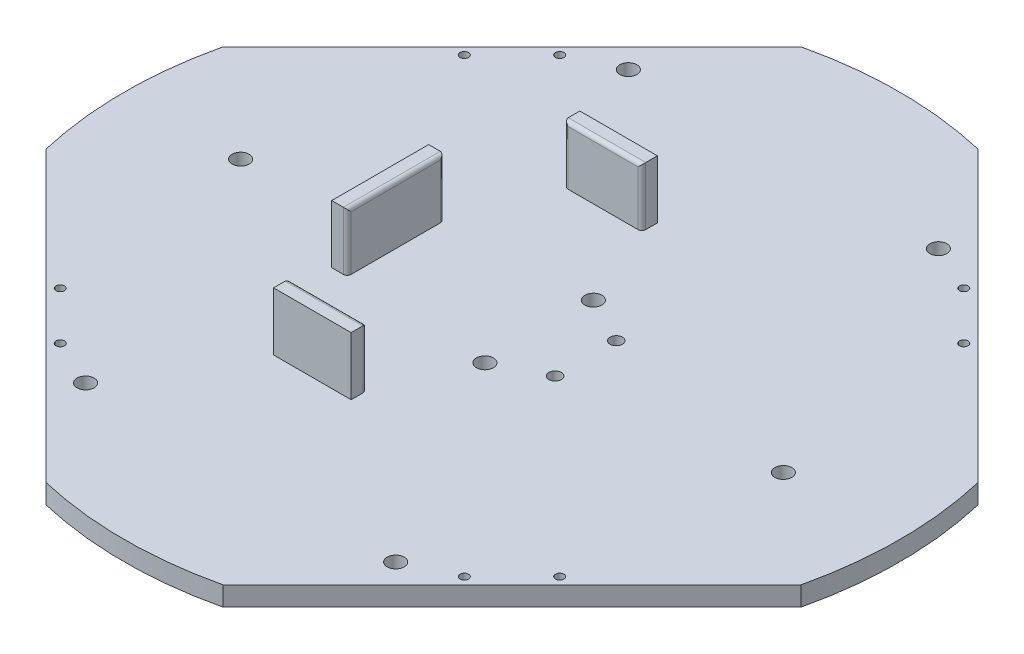
from build123d import *

# Parameters (mm, degrees)
BOSS_EXTRUDE1_DEPTH = 5
SKETCH2_R           = 2.2
CUT_EXTRUDE1_DEPTH  = 142.509716981
SKETCH3_R           = 1.1
SKETCH3_R_2         = 1.6
CUT_EXTRUDE3_DEPTH  = 142.509716981
SKETCH3_3_W         = 20
SKETCH3_3_H         = 4
SKETCH3_3_W_2       = 4
SKETCH3_3_H_2       = 25
BOSS_EXTRUDE2_DEPTH = 15
FILLET1_R           = 1


with BuildPart() as part:
    # Sketch1 → Boss-Extrude1 (new body)
    with BuildSketch(Plane(origin=(0, 0, 0), x_dir=(1, 0, 0), z_dir=(0, 1, 0))):
        with BuildLine():
            Line((97.353237465, -22.854915336), (22.854915336, -97.353237465))
            ThreePointArc((22.854915336, -97.353237465), (0, -100), (-22.854915336, -97.353237465))
            Line((-22.854915336, -97.353237465), (-97.353237465, -22.854915336))
            ThreePointArc((-97.353237465, -22.854915336), (-100, 0), (-97.353237465, 22.854915336))
            Line((-97.353237465, 22.854915336), (-22.854915336, 97.353237465))
            ThreePointArc((-22.854915336, 97.353237465), (0, 100), (22.854915336, 97.353237465))
            Line((22.854915336, 97.353237465), (97.353237465, 22.854915336))
            ThreePointArc((97.353237465, 22.854915336), (100, 0), (97.353237465, -22.854915336))
        make_face()
    extrude(amount=BOSS_EXTRUDE1_DEPTH)

    # Sketch2 → Cut-Extrude1 (cut, through all)
    with BuildSketch(Plane(origin=(0, 5, 0), x_dir=(1, 0, 0), z_dir=(0, 1, 0))):
        with Locations((-40, -70)):
            Circle(SKETCH2_R)
        with Locations((40, -70)):
            Circle(SKETCH2_R)
        with Locations((40, 70)):
            Circle(SKETCH2_R)
        with Locations((-40, 70)):
            Circle(SKETCH2_R)
        with Locations((-70, 0)):
            Circle(SKETCH2_R)
        with Locations((70, 0)):
            Circle(SKETCH2_R)
        with Locations((7, -14)):
            Circle(SKETCH2_R)
        with Locations((7, 14)):
            Circle(SKETCH2_R)
    extrude(amount=-CUT_EXTRUDE1_DEPTH, mode=Mode.SUBTRACT)

    # Sketch3 → Cut-Extrude3 (cut, through all)
    with BuildSketch(Plane(origin=(0, 5, 0), x_dir=(1, 0, 0), z_dir=(0, 1, 0))):
        with Locations((-52.113769773, 64.417427766)):
            Circle(SKETCH3_R)
        with Locations((-64.417427766, 52.113769773)):
            Circle(SKETCH3_R)
        with Locations((64.417427766, 52.113769773)):
            Circle(SKETCH3_R)
        with Locations((52.113769773, 64.417427766)):
            Circle(SKETCH3_R)
        with Locations((52.113769773, -64.417427766)):
            Circle(SKETCH3_R)
        with Locations((64.417427766, -52.113769773)):
            Circle(SKETCH3_R)
        with Locations((-64.417427766, -52.113769773)):
            Circle(SKETCH3_R)
        with Locations((-52.113769773, -64.417427766)):
            Circle(SKETCH3_R)
        with Locations((19.00358005, 7.89)):
            Circle(SKETCH3_R_2)
        with Locations((19.00358005, -7.89)):
            Circle(SKETCH3_R_2)
    extrude(amount=-CUT_EXTRUDE3_DEPTH, mode=Mode.SUBTRACT)

    # Sketch3<3> → Boss-Extrude2 (add)
    with BuildSketch(Plane(origin=(0, 5, 0), x_dir=(1, 0, 0), z_dir=(0, 1, 0))):
        with Locations((-12, 37.5)):
            Rectangle(SKETCH3_3_W, SKETCH3_3_H)
        with Locations((-32, 0)):
            Rectangle(SKETCH3_3_W_2, SKETCH3_3_H_2)
        with Locations((-12, -37.5)):
            Rectangle(SKETCH3_3_W, SKETCH3_3_H)
    extrude(amount=BOSS_EXTRUDE2_DEPTH)

    # Fillet1
    fillet1_edges = [part.edges().sort_by_distance(p)[0] for p in [
        (-22, 12.5, 35.5),
        (-2, 12.5, -35.5),
        (-12, 20, -35.5),
        (-22, 12.5, -35.5),
        (-2, 12.5, 35.5),
        (-30, 12.5, 12.5),
        (-30, 12.5, -12.5),
        (-12, 20, 35.5),
        (-30, 20, 0),
    ]]
    fillet(fillet1_edges, radius=FILLET1_R)


solid = part.part
